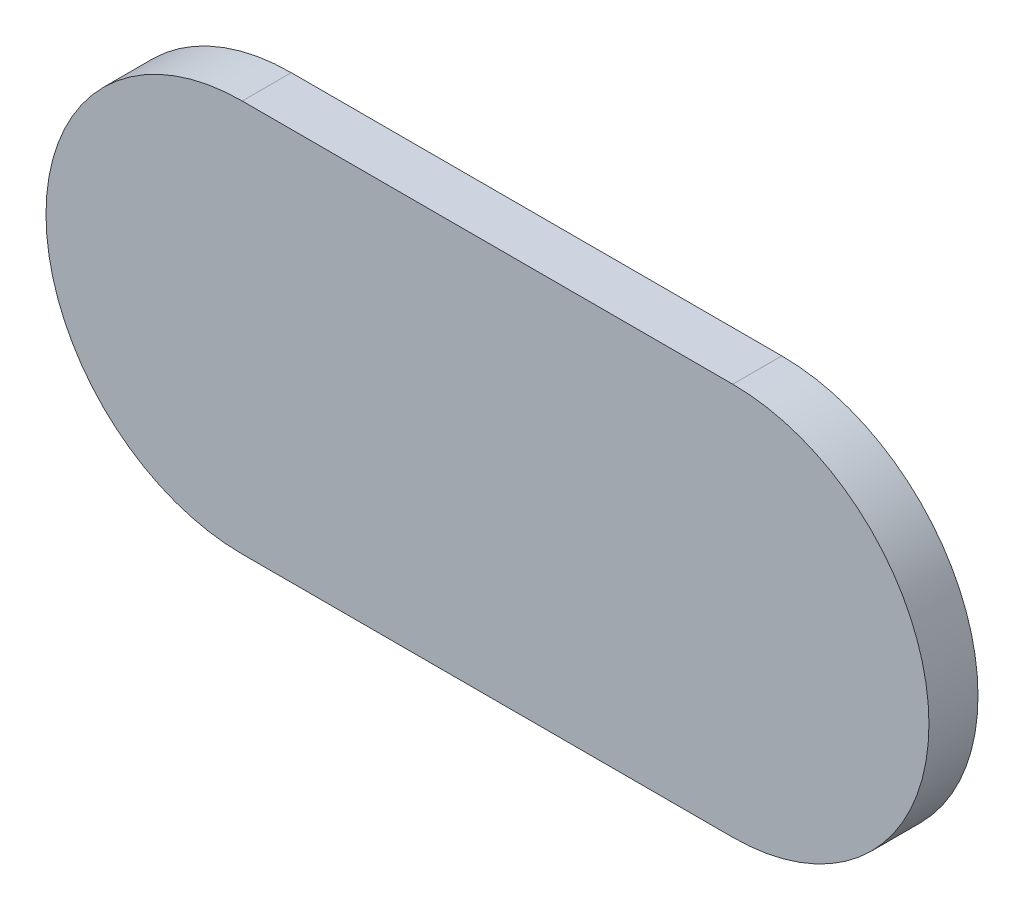
from build123d import *

# Parameters (mm, degrees)
BOSS_EXTRUDE1_DEPTH = 10


with BuildPart() as part:
    # Sketch1 → Boss-Extrude1 (new body)
    with BuildSketch(Plane.XY):
        with BuildLine():
            Line((0, 40), (100, 40))
            ThreePointArc((100, 40), (140, 0), (100, -40))
            Line((100, -40), (0, -40))
            ThreePointArc((0, -40), (-40, 0), (0, 40))
        make_face()
    extrude(amount=BOSS_EXTRUDE1_DEPTH)


solid = part.part
